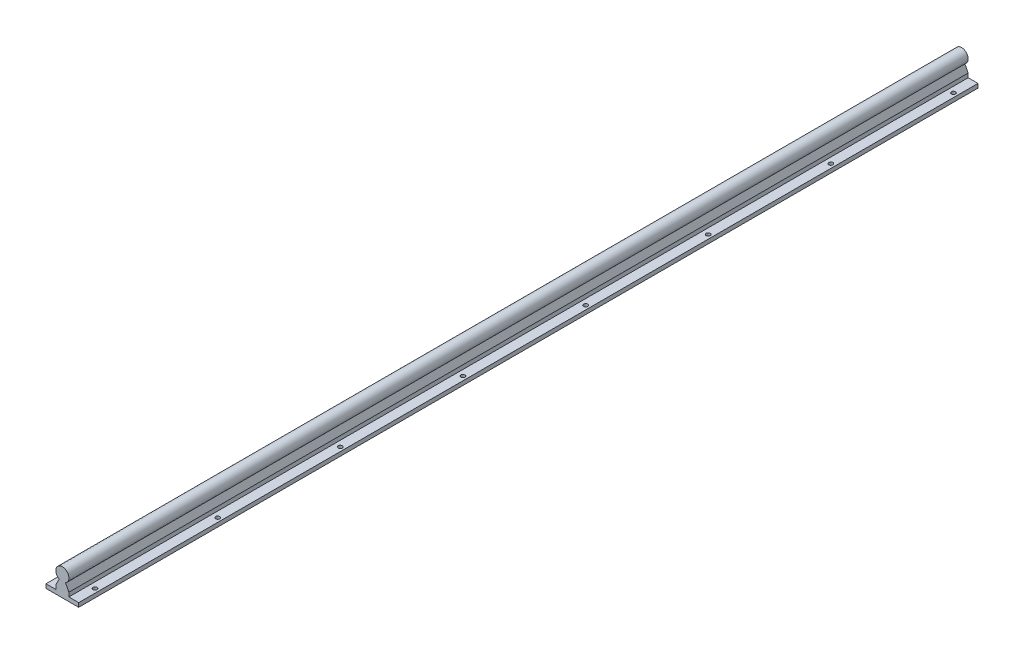
from build123d import *

# Parameters (mm, degrees)
BOSS_EXTRUDE3_DEPTH   = 1100
BOSS_EXTRUDE4_DEPTH   = 1100
F_5_0MM_DOWEL_HOLE1_D = 5
LPATTERN1_COUNT       = 8
LPATTERN1_PITCH       = 150


with BuildPart() as part:
    # Sketch2 → Boss-Extrude3 (new body)
    with BuildSketch(Plane.XY):
        with BuildLine():
            Line((-20, 5), (-20, 0))
            Line((-20, 0), (20, 0))
            Line((20, 0), (20, 5))
            Line((20, 5), (8, 5))
            Line((8, 5), (8, 10))
            Line((8, 10), (3.872983346, 18))
            ThreePointArc((3.872983346, 18), (0, 17), (-3.872983346, 18))
            Line((-3.872983346, 18), (-8, 10))
            Line((-8, 10), (-8, 5))
            Line((-8, 5), (-20, 5))
        make_face()
    extrude(amount=BOSS_EXTRUDE3_DEPTH)

    # Sketch2<4> → Boss-Extrude4 (add)
    with BuildSketch(Plane.XY):
        with BuildLine():
            ThreePointArc((8, 25), (-4.063012013, 31.891439137), (-3.872983346, 18))
            ThreePointArc((-3.872983346, 18), (0, 17), (3.872983346, 18))
            ThreePointArc((3.872983346, 18), (6.891439137, 20.936987987), (8, 25))
        make_face()
    extrude(amount=BOSS_EXTRUDE4_DEPTH)

    # Ø5.0mm Dowel Hole1 (through all)
    with Locations(Plane(origin=(0, 5, 0), x_dir=(1, 0, 0), z_dir=(0, 1, 0))):
        with Locations((15, -1075), (-15, -1075)):
            f_5_0mm_dowel_hole1 = Hole(F_5_0MM_DOWEL_HOLE1_D / 2)

    # LPattern1: Ø5.0mm Dowel Hole1 ×8
    with Locations(*[(0, 0, -i * LPATTERN1_PITCH) for i in range(1, LPATTERN1_COUNT)]):
        add(f_5_0mm_dowel_hole1, mode=Mode.SUBTRACT)


solid = part.part
